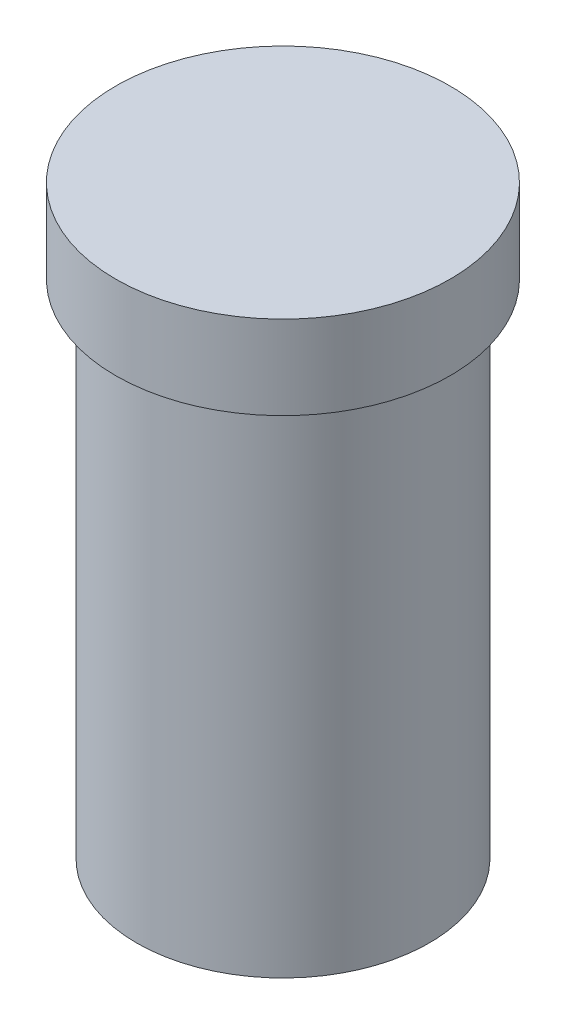
from build123d import *

# Parameters (mm, degrees)
ESQUISSE1_R        = 1.75
BOSS_EXTRU_1_DEPTH = 6
ESQUISSE2_R        = 2
BOSS_EXTRU_2_DEPTH = 1


with BuildPart() as part:
    # Esquisse1 → Boss.-Extru.1 (new body)
    with BuildSketch(Plane(origin=(0, 0, 0), x_dir=(1, 0, 0), z_dir=(0, 1, 0))):
        with Locations(Location((0, 0, 0), (0, 0, 270))):
            Circle(ESQUISSE1_R)
    extrude(amount=-BOSS_EXTRU_1_DEPTH)

    # Esquisse2 → Boss.-Extru.2 (add)
    with BuildSketch(Plane(origin=(0, 0, 0), x_dir=(1, 0, 0), z_dir=(0, 1, 0))):
        with Locations(Location((0, 0, 0), (0, 0, 270))):
            Circle(ESQUISSE2_R)
    extrude(amount=BOSS_EXTRU_2_DEPTH)


solid = part.part
